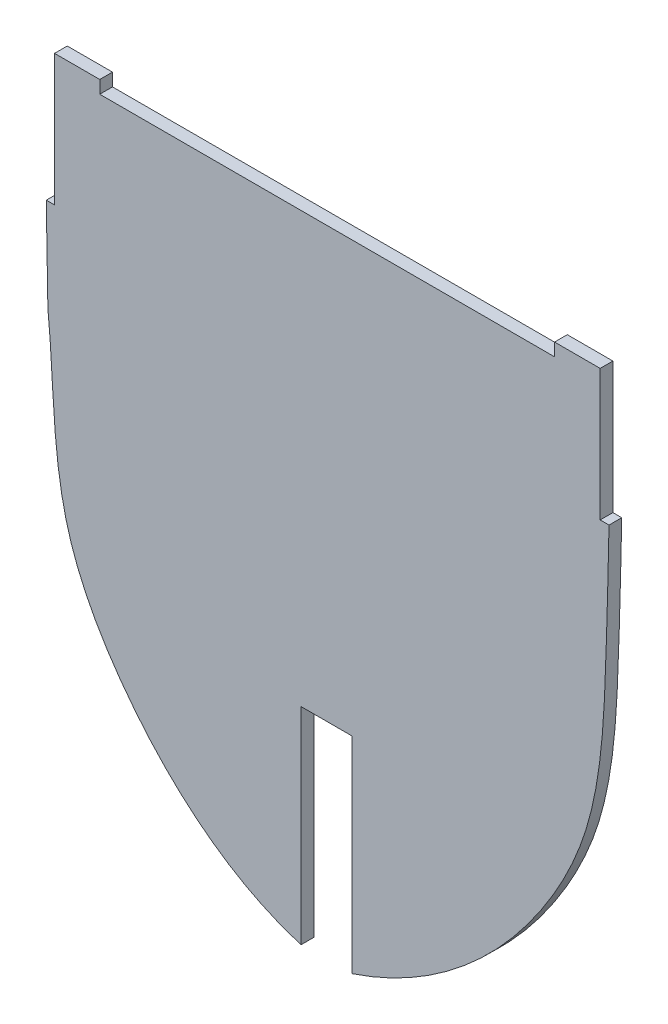
from build123d import *

# Parameters (mm, degrees)
EXTRUDE_1_DEPTH = 2


with BuildPart() as part:
    # 草图1 → 凸台-拉伸1 (new body)
    with BuildSketch(Plane.XY):
        with BuildLine():
            Line((244.967841267, 542.393386476), (173.531139847, 542.393386476))
            Line((173.531139847, 542.393386476), (173.531139847, 544.404513771))
            Line((173.531139847, 544.404513771), (166.427186265, 544.404513771))
            Line((166.427186265, 544.404513771), (166.427186265, 523.784577737))
            Line((166.427186265, 523.784577737), (165.125301121, 523.784577737))
            Line((165.125301121, 523.784577737), (165.381520735, 509.161664861))
            add(Edge.make_bspline(
                [(165.381520735, 509.161664861), (166.398492196, 499.581380375), (165.660716299, 482.596552628), (178.57521294, 459.918617671), (192.311763969, 447.256935323), (203.145863385, 443.111286653), (205.16102947, 442.514323356)],
                knots=[0, 0, 0, 0, 0.348658777, 0.570107959, 0.906139099, 0.980139945, 0.980139945, 0.980139945, 0.980139945], degree=3))
            Line((205.16102947, 442.514323356), (205.16102947, 472.905120341))
            Line((205.16102947, 472.905120341), (205.16102947, 474.905120341))
            Line((205.16102947, 474.905120341), (213.16329184, 474.905120341))
            Line((213.16329184, 474.905120341), (213.16329184, 472.905120341))
            Line((213.16329184, 472.905120341), (213.16329184, 442.577372397))
            add(Edge.make_bspline(
                [(253.521985396, 523.784577737), (253.388891198, 517.565791469), (253.032140526, 502.963496163), (252.103987956, 483.22463858), (243.331777802, 465.610764177), (231.612343059, 451.708919957), (219.961627576, 444.823878536), (213.16329184, 442.577372397)],
                knots=[0, 0, 0, 0, 0.186773646, 0.443708277, 0.581360863, 0.772361396, 0.983204581, 0.983204581, 0.983204581, 0.983204581], degree=3))
            Line((253.521985396, 523.784577737), (252.132324541, 523.784577737))
            Line((252.132324541, 523.784577737), (252.132324541, 544.404513771))
            Line((252.132324541, 544.404513771), (244.967841267, 544.404513771))
            Line((244.967841267, 544.404513771), (244.967841267, 542.393386476))
        make_face()
    extrude(amount=EXTRUDE_1_DEPTH)


solid = part.part
